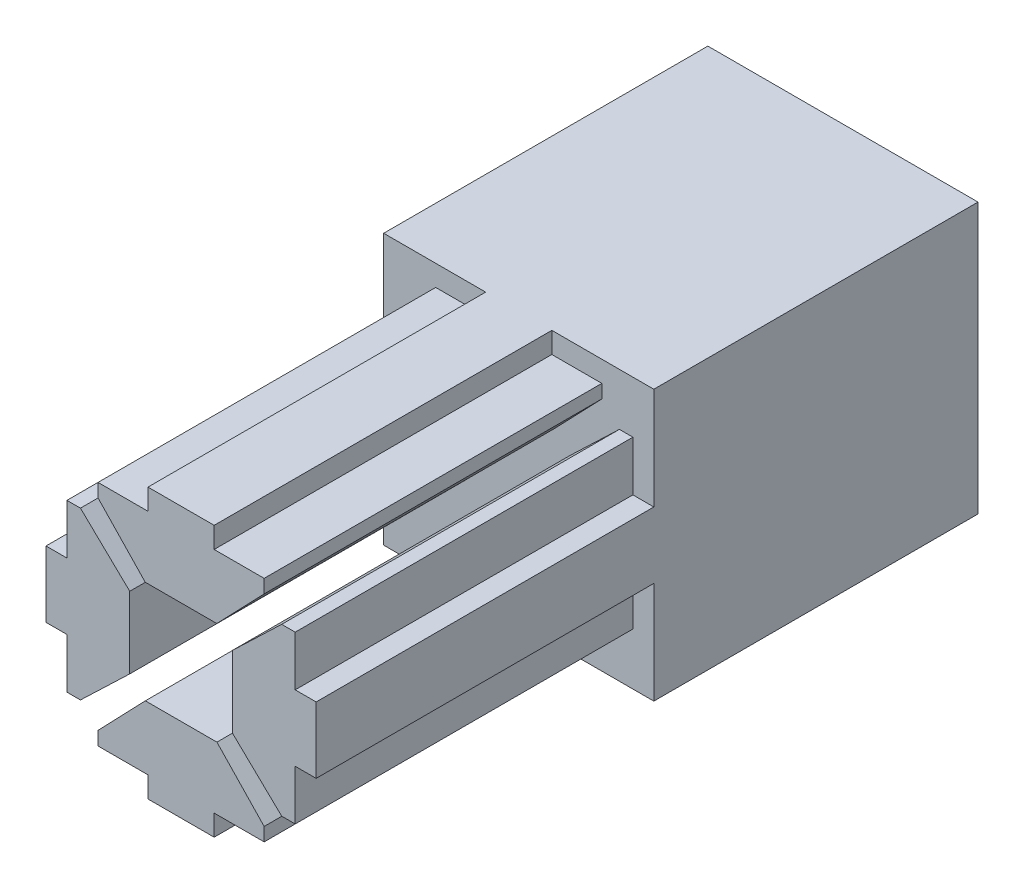
from build123d import *

# Parameters (mm, degrees)
ESQUISSE1_W             = 20
ESQUISSE1_H             = 20
BOSS_EXTRU_1_DEPTH      = 24
BOSS_EXTRU_2_DEPTH      = 25
BOSS_EXTRU_3_DEPTH      = 25
BOSS_EXTRU_4_DEPTH      = 25
BOSS_EXTRU_5_DEPTH      = 25
ESQUISSE6_R             = 3
ENL_V_MAT_EXTRU_1_DEPTH = 22


with BuildPart() as part:
    # Esquisse1 → Boss.-Extru.1 (new body)
    with BuildSketch(Plane.XY):
        Rectangle(ESQUISSE1_W, ESQUISSE1_H)
    extrude(amount=BOSS_EXTRU_1_DEPTH)

    # Esquisse2 → Boss.-Extru.2 (add)
    with BuildSketch(Plane.XY.offset(24)):
        Polygon((-2.45, -10), (-2.45, -8.45), (-6.15, -8.45), (-6.15, -7.45), (-2.645559959, -3.8), (2.654440041, -3.8), (6.15, -7.458505237), (6.15, -8.45), (2.45, -8.45), (2.45, -10), align=None)
    extrude(amount=BOSS_EXTRU_2_DEPTH)

    # Esquisse3 → Boss.-Extru.3 (add)
    with BuildSketch(Plane.XY.offset(24)):
        Polygon((10, -2.45), (8.45, -2.45), (8.45, -6.15), (7.45, -6.15), (3.8, -2.645559959), (3.8, 2.654440041), (7.45, 6.15), (8.45, 6.15), (8.45, 2.45), (10, 2.45), align=None)
    extrude(amount=BOSS_EXTRU_3_DEPTH)

    # Esquisse4 → Boss.-Extru.4 (add)
    with BuildSketch(Plane.XY.offset(24)):
        Polygon((2.45, 10), (2.45, 8.45), (6.15, 8.45), (6.15, 7.45), (2.645559959, 3.8), (-2.654440041, 3.8), (-6.15, 7.458505237), (-6.15, 8.45), (-2.45, 8.45), (-2.45, 10), align=None)
    extrude(amount=BOSS_EXTRU_4_DEPTH)

    # Esquisse5 → Boss.-Extru.5 (add)
    with BuildSketch(Plane.XY.offset(24)):
        Polygon((-10, 2.45), (-8.45, 2.45), (-8.45, 6.15), (-7.45, 6.15), (-3.8, 2.645559959), (-3.8, -2.654440041), (-7.45, -6.15), (-8.45, -6.15), (-8.45, -2.45), (-10, -2.45), align=None)
    extrude(amount=BOSS_EXTRU_5_DEPTH)

    # Esquisse6 → Enlèv. mat.-Extru.1 (cut)
    with BuildSketch(Plane(origin=(0, 0, 0), x_dir=(-1, 0, 0), z_dir=(0, 0, -1))):
        Circle(ESQUISSE6_R)
    extrude(amount=-ENL_V_MAT_EXTRU_1_DEPTH, mode=Mode.SUBTRACT)


solid = part.part
